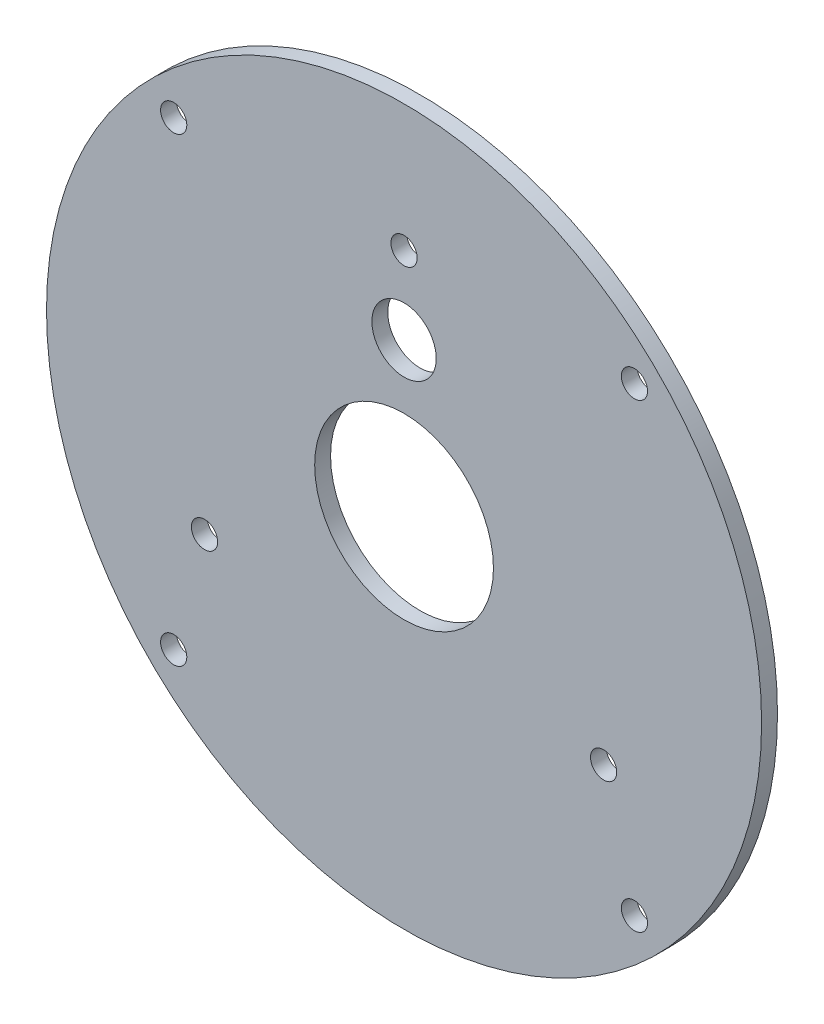
from build123d import *

# Parameters (mm, degrees)
SKETCH_1_R           = 45
SKETCH_1_R_2         = 1.65
SKETCH_1_R_3         = 10.15
EXTRUDE_1_DEPTH      = 10
SKETCH_2_R           = 4.05
CUT_EXTRUDE_1_DEPTH  = 12
SKETCH_5_R           = 34.5
CUT_EXTRUDE_4_DEPTH  = 3
CUT_EXTRUDE_6_DEPTH  = 3
SKETCH_10_R          = 45
CUT_EXTRUDE_9_DEPTH  = 8
SKETCH_11_R          = 11.25
CUT_EXTRUDE_10_DEPTH = 10


with BuildPart() as part:
    # 草图1 → 凸台-拉伸1 (new body)
    with BuildSketch(Plane.XY):
        Circle(SKETCH_1_R)
        with Locations((-28.991378029, 28.991378029)):
            Circle(SKETCH_1_R_2, mode=Mode.SUBTRACT)
        with Locations((28.991378029, 28.991378029)):
            Circle(SKETCH_1_R_2, mode=Mode.SUBTRACT)
        with Locations((-28.991378029, -28.991378029)):
            Circle(SKETCH_1_R_2, mode=Mode.SUBTRACT)
        with Locations((28.991378029, -28.991378029)):
            Circle(SKETCH_1_R_2, mode=Mode.SUBTRACT)
        with Locations((0, 29)):
            Circle(SKETCH_1_R_2, mode=Mode.SUBTRACT)
        with Locations((-25.11473671, -14.5)):
            Circle(SKETCH_1_R_2, mode=Mode.SUBTRACT)
        with Locations((25.11473671, -14.5)):
            Circle(SKETCH_1_R_2, mode=Mode.SUBTRACT)
        Circle(SKETCH_1_R_3, mode=Mode.SUBTRACT)
    extrude(amount=EXTRUDE_1_DEPTH)

    # 草图2 → 切除-拉伸1 (cut)
    with BuildSketch(Plane.XY.offset(10)):
        with Locations((0, 19.25)):
            Circle(SKETCH_2_R)
    extrude(amount=-CUT_EXTRUDE_1_DEPTH, mode=Mode.SUBTRACT)

    # 草图5 → 切除-拉伸4 (cut)
    with BuildSketch(Plane(origin=(0, 0, 0), x_dir=(-1, 0, 0), z_dir=(0, 0, -1))):
        Circle(SKETCH_5_R)
    extrude(amount=-CUT_EXTRUDE_4_DEPTH, mode=Mode.SUBTRACT)

    # 草图7 → 切除-拉伸6 (cut)
    with BuildSketch(Plane(origin=(0, 0, 3), x_dir=(-1, 0, 0), z_dir=(0, 0, -1))):
        Polygon((0, 0), (-25.071115349, -53.76518037), (25.215961405, -54.075803739), align=None)
    extrude(amount=CUT_EXTRUDE_6_DEPTH, mode=Mode.SUBTRACT)

    # 草图10 → 切除-拉伸9 (cut)
    with BuildSketch(Plane(origin=(0, 0, 0), x_dir=(-1, 0, 0), z_dir=(0, 0, -1))):
        Circle(SKETCH_10_R)
    extrude(amount=-CUT_EXTRUDE_9_DEPTH, mode=Mode.SUBTRACT)

    # 草图11 → 切除-拉伸10 (cut)
    with BuildSketch(Plane(origin=(0, 0, 8), x_dir=(-1, 0, 0), z_dir=(0, 0, -1))):
        Circle(SKETCH_11_R)
    extrude(amount=-CUT_EXTRUDE_10_DEPTH, mode=Mode.SUBTRACT)


solid = part.part
